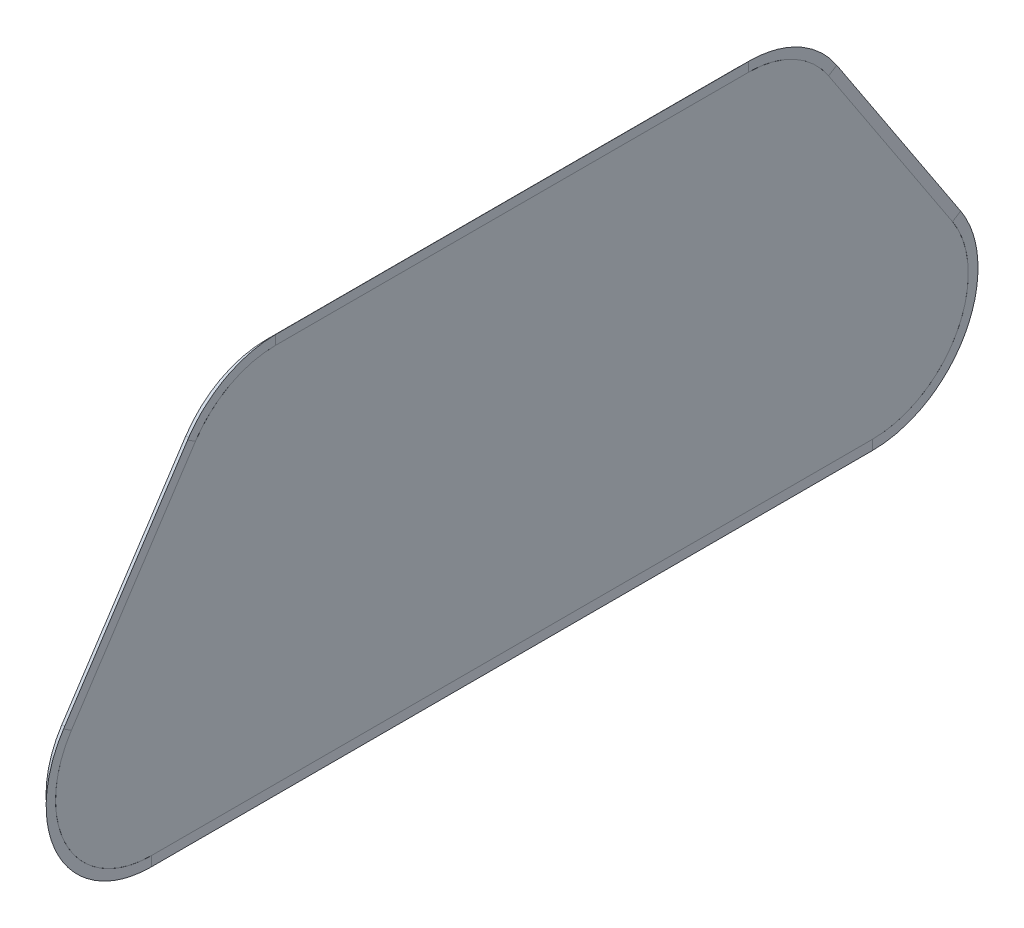
from build123d import *

# Parameters (mm, degrees)
THICKEN1_T1 = 2


with BuildPart() as body_1:
    # Sketch6 → Surface-Plane1: a flat surface bounded by the sketch
    with BuildSketch(Plane(origin=(220, 0, 0), x_dir=(0, 0, -1), z_dir=(1, 0, 0)), mode=Mode.PRIVATE) as surface_plane1_1_region:
        with BuildLine():
            Line((10.544114441, 47.367154835), (109.327040639, 47.367154835))
            ThreePointArc((109.327040639, 47.367154835), (118.816017042, 44.972816618), (126.033011561, 38.363087517))
            Line((126.033011561, 38.363087517), (151.900895956, -0.937637305))
            ThreePointArc((151.900895956, -0.937637305), (152.800586817, -21.422546391), (135.194925034, -31.933569988))
            Line((135.194925034, -31.933569988), (-15.358621791, -31.933569988))
            ThreePointArc((-15.358621791, -31.933569988), (-32.967217144, -21.417101487), (-32.05778866, -0.927306957))
            Line((-32.05778866, -0.927306957), (-6.155052428, 38.373417866))
            ThreePointArc((-6.155052428, 38.373417866), (1.060582941, 44.975750188), (10.544114441, 47.367154835))
        make_face()
    surface_plane1_1 = surface_plane1_1_region.sketch.faces()[0]
    add(Solid.thicken(surface_plane1_1, THICKEN1_T1))


solid = body_1.part
